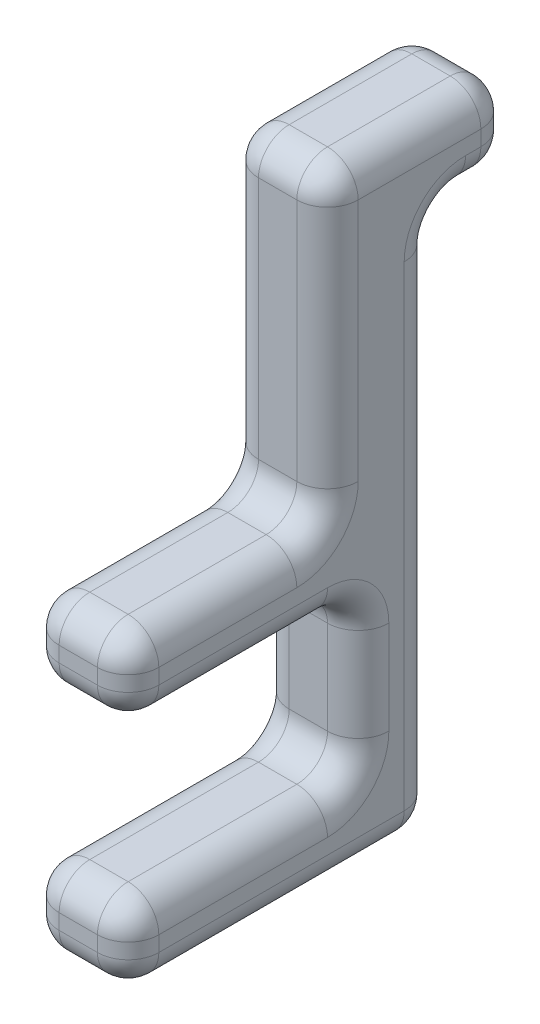
from build123d import *

# Parameters (mm, degrees)
SKETCH1_W           = 6.5
SKETCH1_H           = 40
BOSS_EXTRUDE1_DEPTH = 20
SKETCH2_W           = 15
SKETCH2_H           = 10.1
CUT_EXTRUDE1_DEPTH  = 46.191260217
FILLET1_R           = 2
SKETCH4_W           = 13
SKETCH4_H           = 19.9
CUT_EXTRUDE3_DEPTH  = 46.191260217
SKETCH6_W           = 6.5
SKETCH6_H           = 5
BOSS_EXTRUDE2_DEPTH = 5
FILLET2_R           = 2


with BuildPart() as part:
    # Sketch1 → Boss-Extrude1 (new body)
    with BuildSketch(Plane.XY):
        with Locations((-3.25, 20)):
            Rectangle(SKETCH1_W, SKETCH1_H)
    extrude(amount=BOSS_EXTRUDE1_DEPTH)

    # Sketch2 → Cut-Extrude1 (cut, through all)
    with BuildSketch(Plane(origin=(0, 0, 0), x_dir=(0, 0, -1), z_dir=(1, 0, 0))):
        with Locations((-12.5, 10.05)):
            Rectangle(SKETCH2_W, SKETCH2_H)
    extrude(amount=-CUT_EXTRUDE1_DEPTH, mode=Mode.SUBTRACT)

    # Fillet1
    fillet1_edges = [part.edges().sort_by_distance(p)[0] for p in [
        (-6.5, 15.1, 12.5),
        (-6.5, 10.05, 5),
        (-3.25, 15.1, 5),
        (-6.5, 5, 12.5),
        (-3.25, 5, 5),
        (0, 5, 12.5),
        (0, 10.05, 5),
        (0, 15.1, 12.5),
    ]]
    fillet(fillet1_edges, radius=FILLET1_R)

    # Sketch4 → Cut-Extrude3 (cut, through all)
    with BuildSketch(Plane.ZY.offset(6.5)):
        with Locations((13.5, 30.05)):
            Rectangle(SKETCH4_W, SKETCH4_H)
    extrude(amount=-CUT_EXTRUDE3_DEPTH, mode=Mode.SUBTRACT)

    # Sketch6 → Boss-Extrude2 (add)
    with BuildSketch(Plane(origin=(0, 0, 0), x_dir=(-1, 0, 0), z_dir=(0, 0, -1))):
        with Locations((3.25, 37.5)):
            Rectangle(SKETCH6_W, SKETCH6_H)
    extrude(amount=BOSS_EXTRUDE2_DEPTH)

    # Fillet2
    fillet2_edges = [part.edges().sort_by_distance(p)[0] for p in [
        (-3.25, 0, 20),
        (-6.5, 1.5, 20),
        (-3.25, 5, 20),
        (-0.585786438, 4.414213562, 20),
        (-5.914213562, 4.414213562, 20),
        (0, 18.6, 20),
        (-3.25, 15.1, 20),
        (-0.585786438, 15.685786438, 20),
        (-5.914213562, 15.685786438, 20),
        (0, 1.5, 20),
        (-3.25, 0, 0),
        (0, 17.5, 0),
        (-6.5, 18.6, 20),
        (-6.5, 40, 1),
        (0, 40, 1),
        (0, 20.1, 13.5),
        (-3.25, 20.1, 20),
        (0, 30.05, 7),
        (-3.25, 20.1, 7),
        (-3.25, 40, 7),
        (-6.5, 30.05, 7),
        (-6.5, 20.1, 13.5),
        (-6.5, 17.5, 0),
        (0, 0, 10),
        (-3.25, 35, 0),
        (-6.5, 0, 10),
        (0, 35, -2.5),
        (-6.5, 35, -2.5),
        (0, 37.5, -5),
        (-3.25, 35, -5),
        (-6.5, 37.5, -5),
        (-3.25, 40, -5),
    ]]
    fillet(fillet2_edges, radius=FILLET2_R)


solid = part.part
